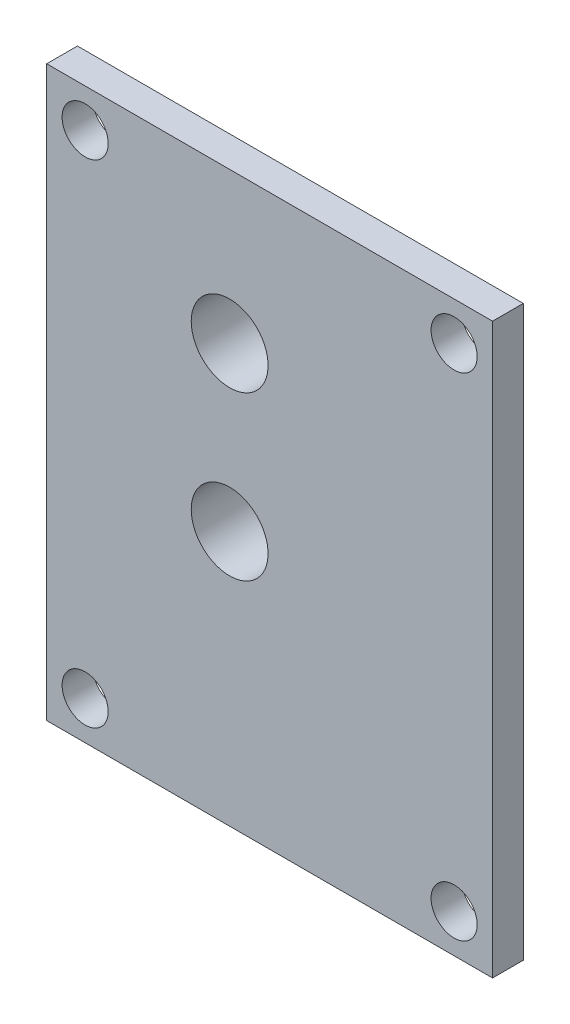
from build123d import *

# Parameters (mm, degrees)
SKETCH2_W           = 19
SKETCH2_H           = 27
SKETCH2_R           = 3.5
BOSS_EXTRUDE1_DEPTH = 2
SKETCH3_R           = 3.5
SKETCH3_R_2         = 2.5
BOSS_EXTRUDE2_DEPTH = 5
FILLET1_R           = 0.5
SKETCH6_W           = 29
SKETCH6_H           = 37
SKETCH6_R           = 1.5
SKETCH6_W_2         = 19
SKETCH6_H_2         = 27
BOSS_EXTRUDE6_DEPTH = 2


with BuildPart() as part:
    # Sketch2 → Boss-Extrude1 (new body)
    with BuildSketch(Plane(origin=(0, 0, 5.662636572), x_dir=(-1, 0, 0), z_dir=(0, 0, -1))):
        with Locations((-66.272536925, 3.74415348)):
            Rectangle(SKETCH2_W, SKETCH2_H)
        with Locations((-63.672536925, 12.44415348)):
            Circle(SKETCH2_R, mode=Mode.SUBTRACT)
        with Locations((-63.672536925, 1.84415348)):
            Circle(SKETCH2_R, mode=Mode.SUBTRACT)
    extrude(amount=BOSS_EXTRUDE1_DEPTH)

    # Sketch3 → Boss-Extrude2 (add)
    # profile 1 of 2: a face of its own
    with BuildSketch(Plane(origin=(0, 0, 5.662636572), x_dir=(-1, 0, 0), z_dir=(0, 0, -1))):
        with Locations((-63.672536925, 12.44415348)):
            Circle(SKETCH3_R)
        with Locations((-63.672536925, 12.44415348)):
            Circle(SKETCH3_R_2, mode=Mode.SUBTRACT)
    # profile 2 of 2: a face of its own
    with BuildSketch(Plane(origin=(0, 0, 5.662636572), x_dir=(-1, 0, 0), z_dir=(0, 0, -1))):
        with Locations((-63.672536925, 1.84415348)):
            Circle(SKETCH3_R)
        with Locations((-63.672536925, 1.84415348)):
            Circle(SKETCH3_R_2, mode=Mode.SUBTRACT)
    extrude(amount=BOSS_EXTRUDE2_DEPTH)

    # Fillet1
    fillet1_edges = [part.edges().sort_by_distance(p)[0] for p in [
        (67.172536925, 12.44415348, 0.662636572),
        (67.172536925, 1.84415348, 0.662636572),
    ]]
    fillet(fillet1_edges, radius=FILLET1_R)

    # Sketch6 → Boss-Extrude6 (add)
    with BuildSketch(Plane.XY.offset(5.662636572)):
        with Locations((66.272536925, 3.74415348)):
            Rectangle(SKETCH6_W, SKETCH6_H)
        with Locations((54.272536925, 19.74415348)):
            Circle(SKETCH6_R, mode=Mode.SUBTRACT)
        with Locations((78.272536925, 19.74415348)):
            Circle(SKETCH6_R, mode=Mode.SUBTRACT)
        with Locations((78.272536925, -12.25584652)):
            Circle(SKETCH6_R, mode=Mode.SUBTRACT)
        with Locations((54.272536925, -12.25584652)):
            Circle(SKETCH6_R, mode=Mode.SUBTRACT)
        with Locations((66.272536925, 3.74415348)):
            Rectangle(SKETCH6_W_2, SKETCH6_H_2, mode=Mode.SUBTRACT)
    extrude(amount=-BOSS_EXTRUDE6_DEPTH)


solid = part.part
